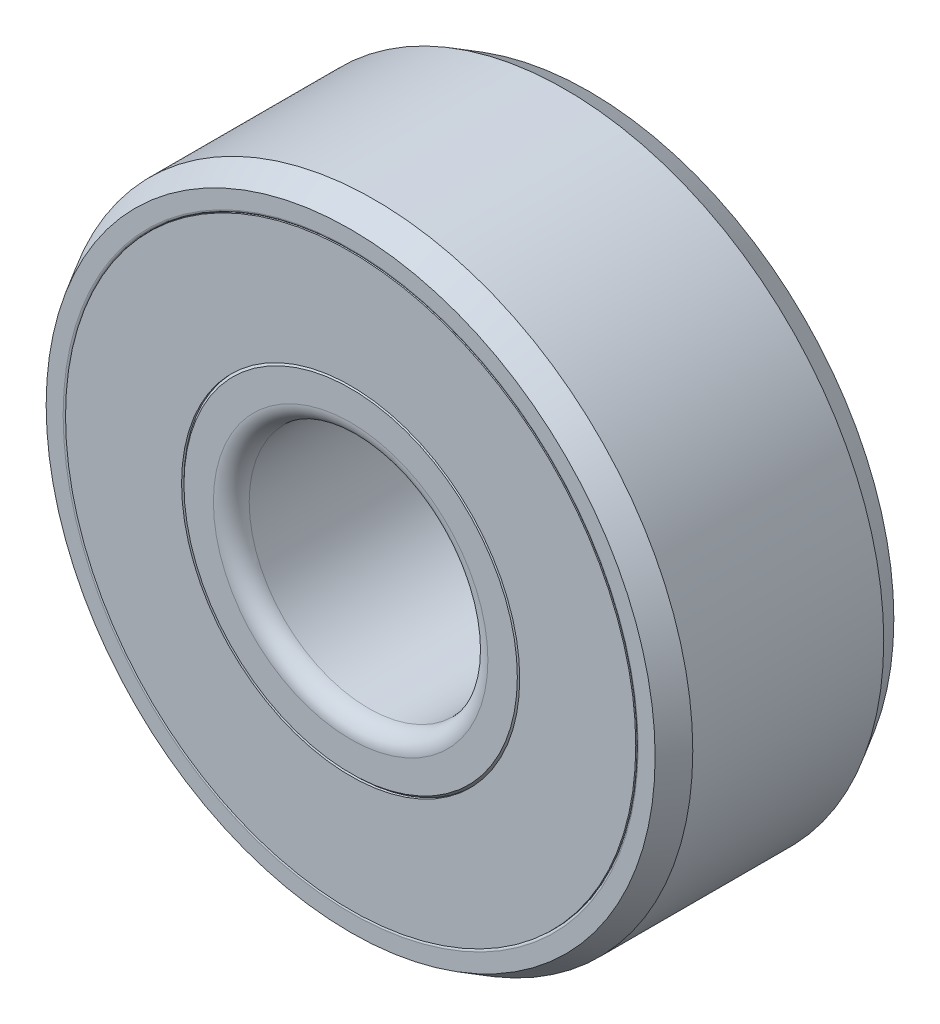
from build123d import *

# Parameters (mm, degrees)
SKETCH4_W         = 0.369791667
SKETCH4_H         = 1.458333333
CIRPATTERN1_COUNT = 7


with BuildPart() as part:
    # Sketch3 → Revolve1 (revolve)
    with BuildSketch(Plane(origin=(0, 0, 0), x_dir=(0, 0, -1), z_dir=(1, 0, 0)), mode=Mode.PRIVATE) as revolve1_sk:
        with BuildLine():
            Line((-1.2, -4), (1.2, -4))
            Line((1.2, -4), (1.5, -3.826794919))
            Line((1.5, -3.826794919), (1.5, -3.613333333))
            ThreePointArc((1.5, -3.613333333), (1.491213203, -3.59212013), (1.47, -3.583333333))
            Line((1.47, -3.583333333), (0.694444444, -3.583333333))
            ThreePointArc((0.694444444, -3.583333333), (0, -3.861111111), (-0.694444444, -3.583333333))
            Line((-0.694444444, -3.583333333), (-1.47, -3.583333333))
            ThreePointArc((-1.47, -3.583333333), (-1.491213203, -3.59212013), (-1.5, -3.613333333))
            Line((-1.5, -3.613333333), (-1.5, -3.826794919))
            Line((-1.5, -3.826794919), (-1.2, -4))
        make_face()
        with BuildLine():
            Line((-1.275, -1.5), (1.275, -1.5))
            ThreePointArc((1.275, -1.5), (1.434099026, -1.565900974), (1.5, -1.725))
            Line((1.5, -1.725), (1.5, -2.095))
            Line((1.5, -2.095), (1.47, -2.125))
            Line((1.47, -2.125), (0.694444444, -2.125))
            ThreePointArc((0.694444444, -2.125), (0, -1.847222222), (-0.694444444, -2.125))
            Line((-0.694444444, -2.125), (-1.47, -2.125))
            Line((-1.47, -2.125), (-1.5, -2.095))
            Line((-1.5, -2.095), (-1.5, -1.725))
            ThreePointArc((-1.5, -1.725), (-1.434099026, -1.565900974), (-1.275, -1.5))
        make_face()
    revolve(revolve1_sk.sketch.rotate(Axis((0, 0, 1.5), (0, 0, -1)), 270), axis=Axis((0, 0, 1.5), (0, 0, -1)))


with BuildPart() as body_2:
    # Sketch4 → Revolve2 (revolve)
    with BuildSketch(Plane(origin=(0, 0, 0), x_dir=(0, 0, -1), z_dir=(1, 0, 0)), mode=Mode.PRIVATE) as revolve2_sk:
        with Locations((-1.315104167, -2.854166667)):
            Rectangle(SKETCH4_W, SKETCH4_H)
    revolve(revolve2_sk.sketch.rotate(Axis((0, 0, 1.5), (0, 0, -1)), 270), axis=Axis((0, 0, 1.5), (0, 0, -1)))


with BuildPart() as body_3:
    # Sketch5 → Revolve3 (revolve)
    with BuildSketch(Plane(origin=(0, 0, 0), x_dir=(0, 0, -1), z_dir=(1, 0, 0))):
        with BuildLine():
            Line((0, -1.847222222), (0, -3.861111111))
            ThreePointArc((0, -3.861111111), (-1.006944444, -2.854166667), (0, -1.847222222))
        make_face()
    revolve(axis=Axis((0, 0, 0), (0, -1, 0)))


with BuildPart() as cirpattern1_1:
    # CirPattern1: pattern copy
    add(body_3.part.rotate(Axis((0, 0, 0), (0, 0, 1)), 1 * 360 / CIRPATTERN1_COUNT))


with BuildPart() as cirpattern1_2:
    # CirPattern1: pattern copy
    add(body_3.part.rotate(Axis((0, 0, 0), (0, 0, 1)), 2 * 360 / CIRPATTERN1_COUNT))


with BuildPart() as cirpattern1_3:
    # CirPattern1: pattern copy
    add(body_3.part.rotate(Axis((0, 0, 0), (0, 0, 1)), 3 * 360 / CIRPATTERN1_COUNT))


with BuildPart() as cirpattern1_4:
    # CirPattern1: pattern copy
    add(body_3.part.rotate(Axis((0, 0, 0), (0, 0, 1)), 4 * 360 / CIRPATTERN1_COUNT))


with BuildPart() as cirpattern1_5:
    # CirPattern1: pattern copy
    add(body_3.part.rotate(Axis((0, 0, 0), (0, 0, 1)), 5 * 360 / CIRPATTERN1_COUNT))


with BuildPart() as cirpattern1_6:
    # CirPattern1: pattern copy
    add(body_3.part.rotate(Axis((0, 0, 0), (0, 0, 1)), 6 * 360 / CIRPATTERN1_COUNT))


solid = Compound([part.part, body_2.part, body_3.part, cirpattern1_1.part, cirpattern1_2.part, cirpattern1_3.part, cirpattern1_4.part, cirpattern1_5.part, cirpattern1_6.part])
